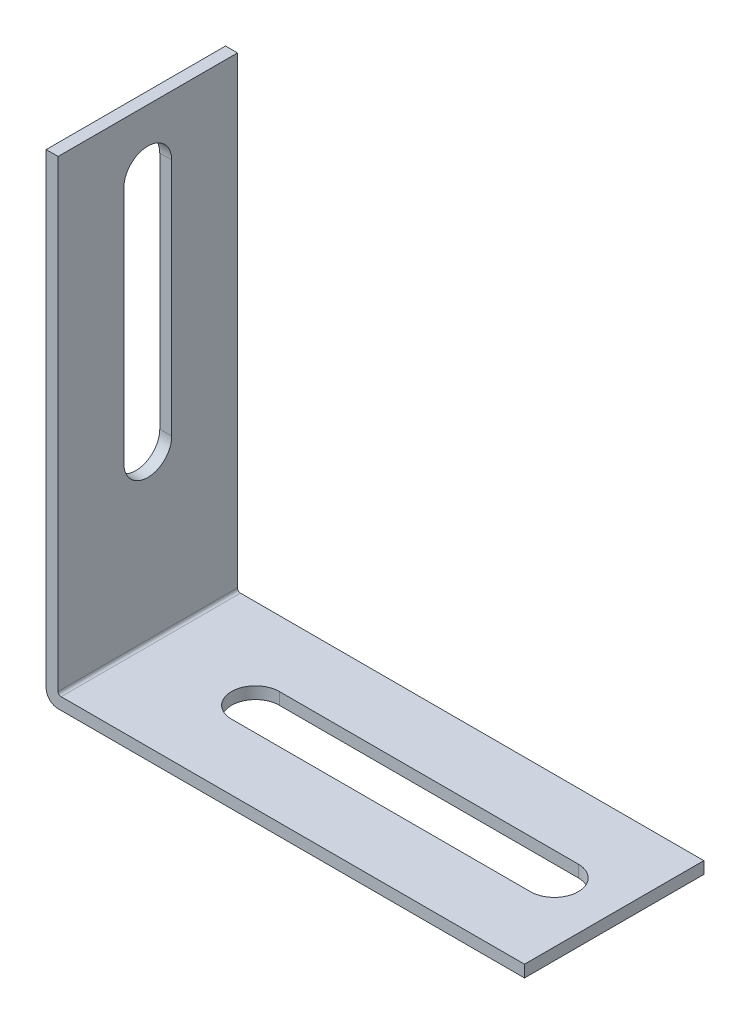
from build123d import *

# Parameters (mm, degrees)
BOSS_EXTRUDE1_DEPTH = 30
CUT_EXTRUDE1_REACH  = 117.689
CUT_EXTRUDE2_REACH  = 117.689


with BuildPart() as part:
    # Sketch1 → Boss-Extrude1 (new body)
    with BuildSketch(Plane.XY):
        with BuildLine():
            Line((0, 80), (0, 2))
            ThreePointArc((0, 2), (0.585786438, 0.585786438), (2, 0))
            Line((2, 0), (80, 0))
            Line((80, 0), (80, 2))
            Line((80, 2), (2.5, 2))
            ThreePointArc((2.5, 2), (2.146446609, 2.146446609), (2, 2.5))
            Line((2, 2.5), (2, 80))
            Line((2, 80), (0, 80))
        make_face()
    extrude(amount=BOSS_EXTRUDE1_DEPTH)

    # Sketch2 → Cut-Extrude1 (cut, up to next)
    with BuildSketch(Plane(origin=(0, 2, 0), x_dir=(1, 0, 0), z_dir=(0, 1, 0)), mode=Mode.PRIVATE) as cut_extrude1_sk1:
        with BuildLine():
            Line((70, -19), (20, -19))
            ThreePointArc((20, -19), (16, -15), (20, -11))
            Line((20, -11), (70, -11))
            ThreePointArc((70, -11), (74, -15), (70, -19))
        make_face()
    cut_extrude1_tool1 = extrude(cut_extrude1_sk1.sketch, amount=-CUT_EXTRUDE1_REACH, mode=Mode.PRIVATE) & part.part
    add(cut_extrude1_tool1.solids().sort_by_distance((45, 2, 15))[0], mode=Mode.SUBTRACT)

    # Sketch3 → Cut-Extrude2 (cut, up to next)
    with BuildSketch(Plane(origin=(2, 0, 0), x_dir=(0, 0, -1), z_dir=(1, 0, 0)), mode=Mode.PRIVATE) as cut_extrude2_sk1:
        with BuildLine():
            Line((-11, 70), (-11, 30))
            ThreePointArc((-11, 30), (-15, 26), (-19, 30))
            Line((-19, 30), (-19, 70))
            ThreePointArc((-19, 70), (-15, 74), (-11, 70))
        make_face()
    cut_extrude2_tool1 = extrude(cut_extrude2_sk1.sketch, amount=-CUT_EXTRUDE2_REACH, mode=Mode.PRIVATE) & part.part
    add(cut_extrude2_tool1.solids().sort_by_distance((2, 50, 15))[0], mode=Mode.SUBTRACT)


solid = part.part
